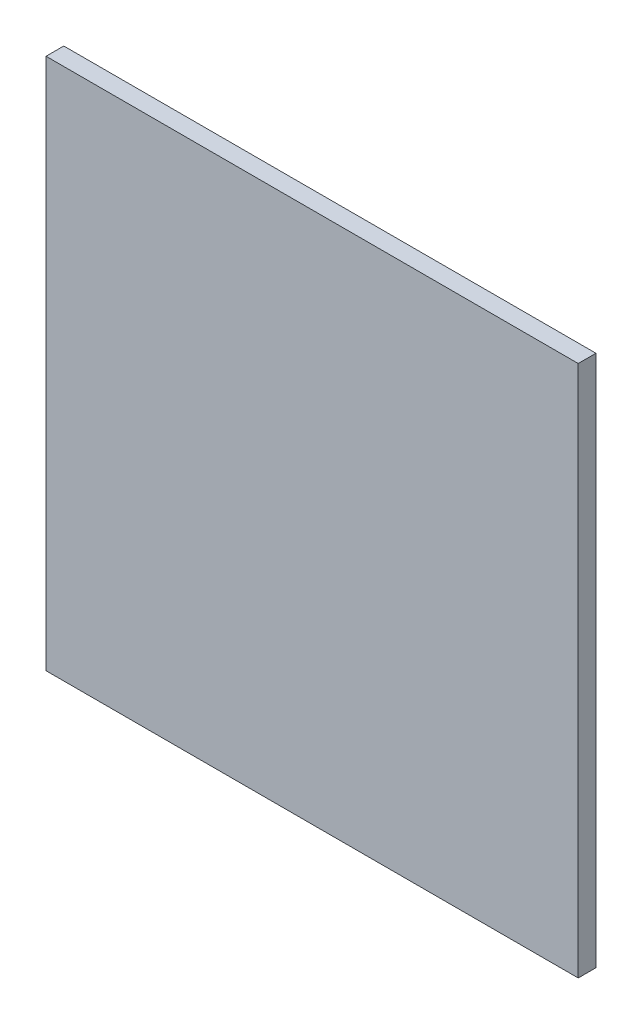
from build123d import *

# Parameters (mm, degrees)
CROQUIS1_W              = 15
CROQUIS1_H              = 15
SALIENTE_EXTRUIR1_DEPTH = 0.5


with BuildPart() as part:
    # Croquis1 → Saliente-Extruir1 (new body)
    with BuildSketch(Plane.XY):
        Rectangle(CROQUIS1_W, CROQUIS1_H)
    extrude(amount=SALIENTE_EXTRUIR1_DEPTH)


solid = part.part
